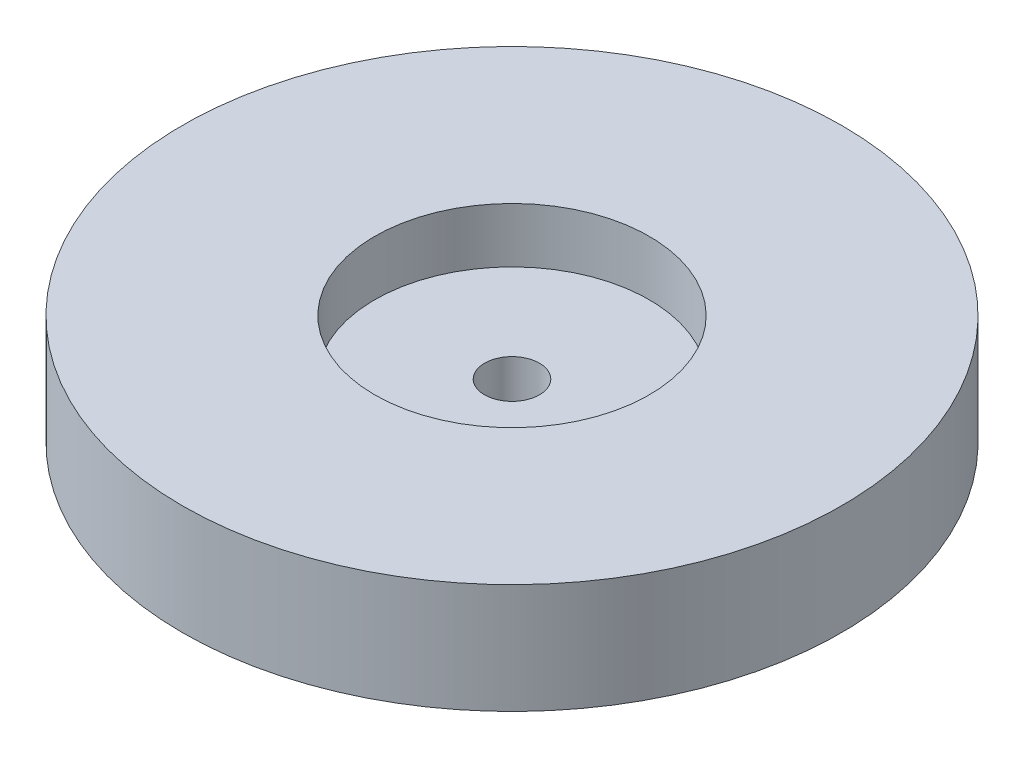
from build123d import *

# Parameters (mm, degrees)
SKETCH1_R           = 30
SKETCH1_R_2         = 12.5
BOSS_EXTRUDE1_DEPTH = 10
SKETCH1_3_R         = 12.5
SKETCH1_3_R_2       = 2.5
BOSS_EXTRUDE2_DEPTH = 5


with BuildPart() as part:
    # Sketch1 → Boss-Extrude1 (new body)
    with BuildSketch(Plane(origin=(0, 0, 0), x_dir=(1, 0, 0), z_dir=(0, 1, 0))):
        Circle(SKETCH1_R)
        Circle(SKETCH1_R_2, mode=Mode.SUBTRACT)
    extrude(amount=BOSS_EXTRUDE1_DEPTH)

    # Sketch1<3> → Boss-Extrude2 (add)
    with BuildSketch(Plane(origin=(0, 0, 0), x_dir=(1, 0, 0), z_dir=(0, 1, 0))):
        Circle(SKETCH1_3_R)
        Circle(SKETCH1_3_R_2, mode=Mode.SUBTRACT)
    extrude(amount=BOSS_EXTRUDE2_DEPTH)


solid = part.part
